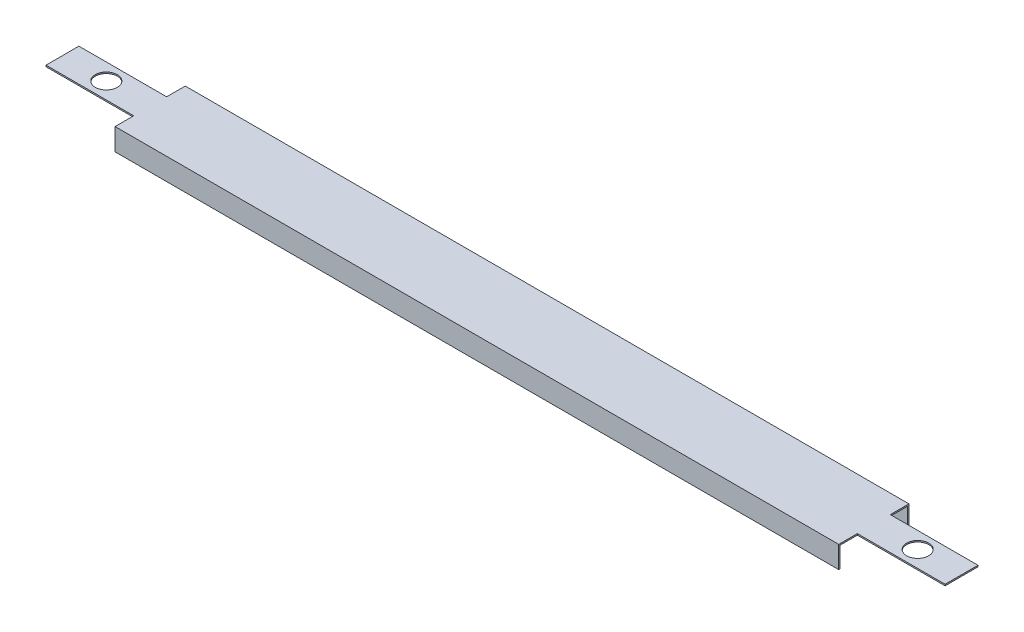
from build123d import *

# Parameters (mm, degrees)
SKETCH2_W           = 260.35
SKETCH2_H           = 20.32
SKETCH2_R           = 3.1877
BOSS_EXTRUDE1_DEPTH = 6.35
SKETCH3_W           = 19.5072
SKETCH3_H           = 5.9436
CUT_EXTRUDE1_DEPTH  = 261.625537122
SKETCH4_W           = 25.4
SKETCH4_H           = 5.3975
CUT_EXTRUDE2_DEPTH  = 131.725203098


with BuildPart() as part:
    # Sketch2 → Boss-Extrude1 (new body)
    with BuildSketch(Plane(origin=(0, 0, 0), x_dir=(1, 0, 0), z_dir=(0, 1, 0))):
        Rectangle(SKETCH2_W, SKETCH2_H)
        with Locations(Location((-117.475, 0, 0), (0, 0, 270))):
            Circle(SKETCH2_R, mode=Mode.SUBTRACT)
        with Locations(Location((117.475, 0, 0), (0, 0, 270))):
            Circle(SKETCH2_R, mode=Mode.SUBTRACT)
    extrude(amount=-BOSS_EXTRUDE1_DEPTH)

    # Sketch3 → Cut-Extrude1 (cut, through all)
    with BuildSketch(Plane(origin=(130.175, 0, 0), x_dir=(0, 0, -1), z_dir=(1, 0, 0))):
        with Locations((0, -3.3782)):
            Rectangle(SKETCH3_W, SKETCH3_H)
    extrude(amount=-CUT_EXTRUDE1_DEPTH, mode=Mode.SUBTRACT)

    # Sketch4 → Cut-Extrude2 (cut, through all)
    with BuildSketch(Plane(origin=(0, 0, 0), x_dir=(1, 0, 0), z_dir=(0, 1, 0))):
        with Locations((-117.475, 7.46125)):
            Rectangle(SKETCH4_W, SKETCH4_H)
        with Locations((-117.475, -7.46125)):
            Rectangle(SKETCH4_W, SKETCH4_H)
        with Locations((117.475, 7.46125)):
            Rectangle(SKETCH4_W, SKETCH4_H)
        with Locations((117.475, -7.46125)):
            Rectangle(SKETCH4_W, SKETCH4_H)
    extrude(amount=-CUT_EXTRUDE2_DEPTH, mode=Mode.SUBTRACT)


solid = part.part
